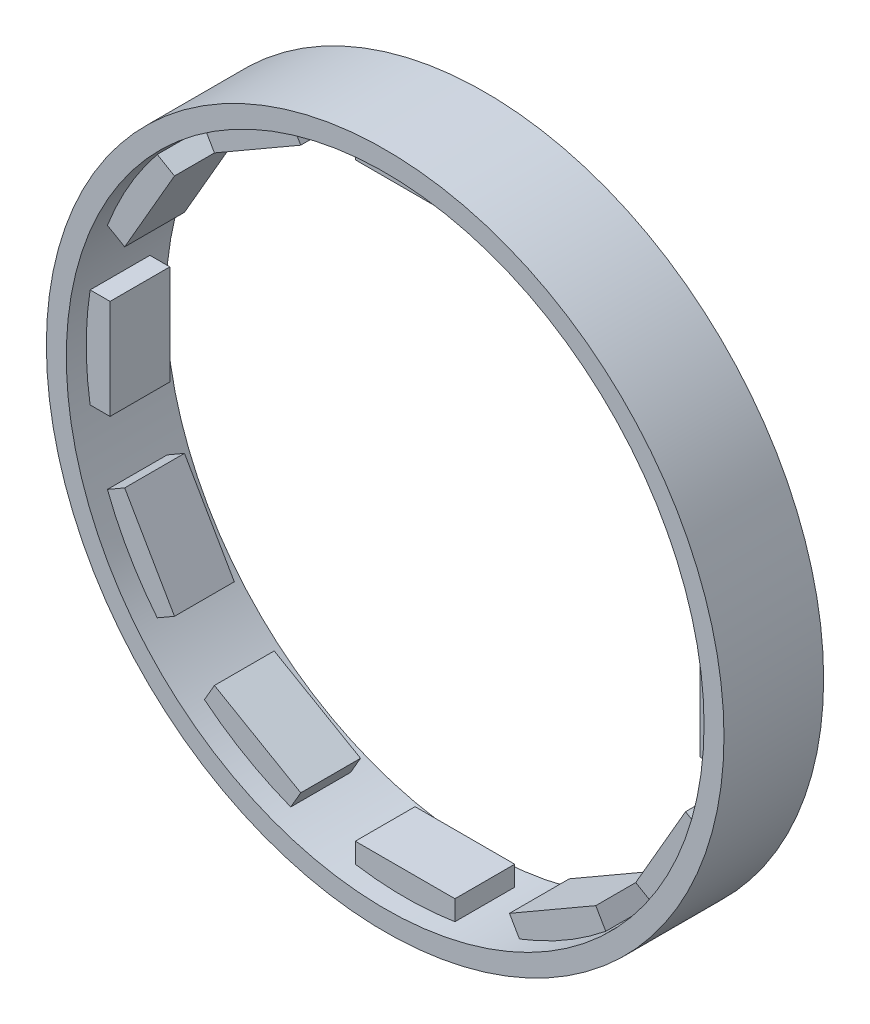
from build123d import *

# Parameters (mm, degrees)
SKETCH15_R          = 17
SKETCH15_R_2        = 16
BOSS_EXTRUDE1_DEPTH = 5
BOSS_EXTRUDE2_DEPTH = 1.5
CIRPATTERN1_COUNT   = 12


with BuildPart() as part:
    # Sketch15 → Boss-Extrude1 (new body)
    with BuildSketch(Plane.XY):
        Circle(SKETCH15_R)
        Circle(SKETCH15_R_2, mode=Mode.SUBTRACT)
    extrude(amount=BOSS_EXTRUDE1_DEPTH)

    # Sketch16 → Boss-Extrude2 (add, symmetric)
    with BuildSketch(Plane(origin=(0, 0, 2.5), x_dir=(-1, 0, 0), z_dir=(0, 0, -1))):
        with BuildLine():
            Line((2.5, 14.803480629), (2.5, 15.803480629))
            ThreePointArc((2.5, 15.803480629), (0, 16), (-2.5, 15.803480629))
            Line((-2.5, 15.803480629), (-2.5, 14.803480629))
            Line((-2.5, 14.803480629), (2.5, 14.803480629))
        make_face()
    boss_extrude2 = extrude(amount=BOSS_EXTRUDE2_DEPTH, both=True)

    # CirPattern1: Boss-Extrude2 ×12 about axis
    cirpattern1_axis = Axis((0, 0, 0), (0, 0, 1))
    for i in range(1, CIRPATTERN1_COUNT):
        add(boss_extrude2.rotate(cirpattern1_axis, i * 360 / CIRPATTERN1_COUNT))


solid = part.part
